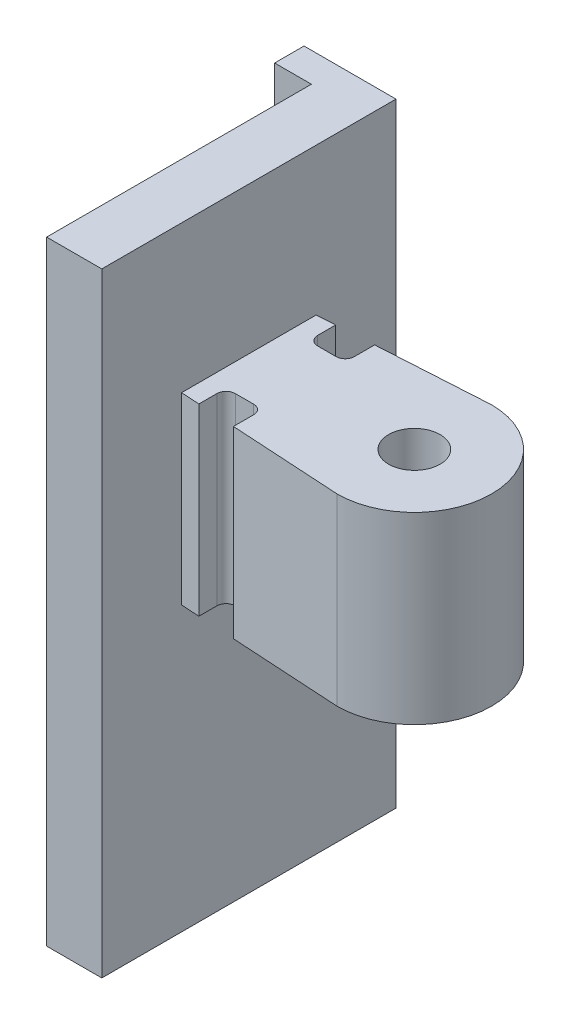
from build123d import *

# Parameters (mm, degrees)
BOSS_EXTRUDE1_DEPTH      = 2.5
SKETCH4_R                = 0.35
THROUGH_HOLES_DEPTH      = 4.688156721
FILLET1_R                = 0.125
BOSS_EXTRUDE4_DEPTH      = 0.5
BOSS_EXTRUDE4_DEPTH_BACK = 0.25
SKETCH11_W               = 4
SKETCH11_H               = 8.35
SKETCH12_W               = 0.4
SKETCH12_H               = 8.35
BOSS_EXTRUDE5_DEPTH      = 0.5


with BuildPart() as part:
    # Sketch3 → Boss-Extrude1 (new body)
    with BuildSketch(Plane(origin=(0, 0, 0), x_dir=(1, 0, 0), z_dir=(0, 1, 0))):
        with BuildLine():
            Line((-2.5, 0.9), (-2, 0.93))
            Line((-2, 0.93), (-2, 0.56))
            Line((-2, 0.56), (-1.5, 0.56))
            Line((-1.5, 0.56), (-1.5, 0.96))
            Line((-1.5, 0.96), (0, 1.05))
            ThreePointArc((0, 1.05), (1.05, 0), (0, -1.05))
            Line((0, -1.05), (-1.5, -0.96))
            Line((-1.5, -0.96), (-1.5, -0.56))
            Line((-1.5, -0.56), (-2, -0.56))
            Line((-2, -0.56), (-2, -0.93))
            Line((-2, -0.93), (-2.5, -0.9))
            Line((-2.5, -0.9), (-2.5, 0.9))
        make_face()
    extrude(amount=BOSS_EXTRUDE1_DEPTH)

    # Sketch4 → Through Holes (cut, through all)
    with BuildSketch(Plane(origin=(0, 2.5, 0), x_dir=(1, 0, 0), z_dir=(0, 1, 0))):
        with Locations(Location((0, 0, 0), (0, 0, 270))):
            Circle(SKETCH4_R)
    extrude(amount=-THROUGH_HOLES_DEPTH, mode=Mode.SUBTRACT)

    # Fillet1
    fillet1_edges = [part.edges().sort_by_distance(p)[0] for p in [
        (-2, 1.25, -0.56),
        (-1.5, 1.25, -0.56),
        (-1.5, 1.25, 0.56),
        (-2, 1.25, 0.56),
    ]]
    fillet(fillet1_edges, radius=FILLET1_R)

    # Sketch11 → Boss-Extrude4 (add, two sides: drawn at the far end of the back side and taken through both)
    with BuildSketch(Plane.ZY.offset(2.5).offset(-BOSS_EXTRUDE4_DEPTH_BACK)):
        with Locations((0, 0.325)):
            Rectangle(SKETCH11_W, SKETCH11_H)
    extrude(amount=BOSS_EXTRUDE4_DEPTH + BOSS_EXTRUDE4_DEPTH_BACK)

    # Sketch12 → Boss-Extrude5 (add)
    with BuildSketch(Plane.ZY.offset(3)):
        with Locations((-1.8, 0.325)):
            Rectangle(SKETCH12_W, SKETCH12_H)
    extrude(amount=BOSS_EXTRUDE5_DEPTH)


solid = part.part
